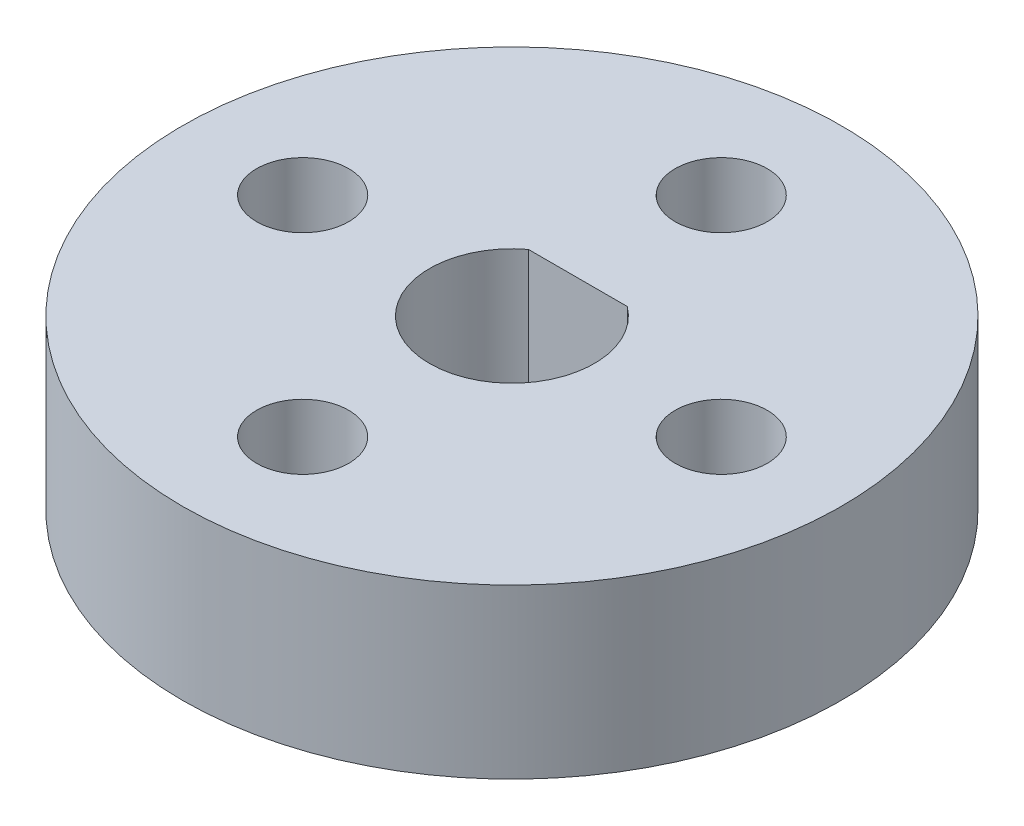
from build123d import *

# Parameters (mm, degrees)
SKETCH1_R           = 10
SKETCH1_R_2         = 1.397
BOSS_EXTRUDE2_DEPTH = 5.1


with BuildPart() as part:
    # Sketch1 → Boss-Extrude2 (new body)
    with BuildSketch(Plane(origin=(0, 0, 0), x_dir=(1, 0, 0), z_dir=(0, 1, 0))):
        with Locations(Location((0, 0, 0), (0, 0, 270))):
            Circle(SKETCH1_R)
        with BuildLine():
            Line((-1.5, 2), (1.5, 2))
            ThreePointArc((1.5, 2), (0, -2.5), (-1.5, 2))
        make_face(mode=Mode.SUBTRACT)
        with Locations(Location((-6.35, 0, 0), (0, 0, 270))):
            Circle(SKETCH1_R_2, mode=Mode.SUBTRACT)
        with Locations(Location((0, -6.35, 0), (0, 0, 270))):
            Circle(SKETCH1_R_2, mode=Mode.SUBTRACT)
        with Locations(Location((0, 6.35, 0), (0, 0, 270))):
            Circle(SKETCH1_R_2, mode=Mode.SUBTRACT)
        with Locations(Location((6.35, 0, 0), (0, 0, 270))):
            Circle(SKETCH1_R_2, mode=Mode.SUBTRACT)
    extrude(amount=BOSS_EXTRUDE2_DEPTH)


solid = part.part
